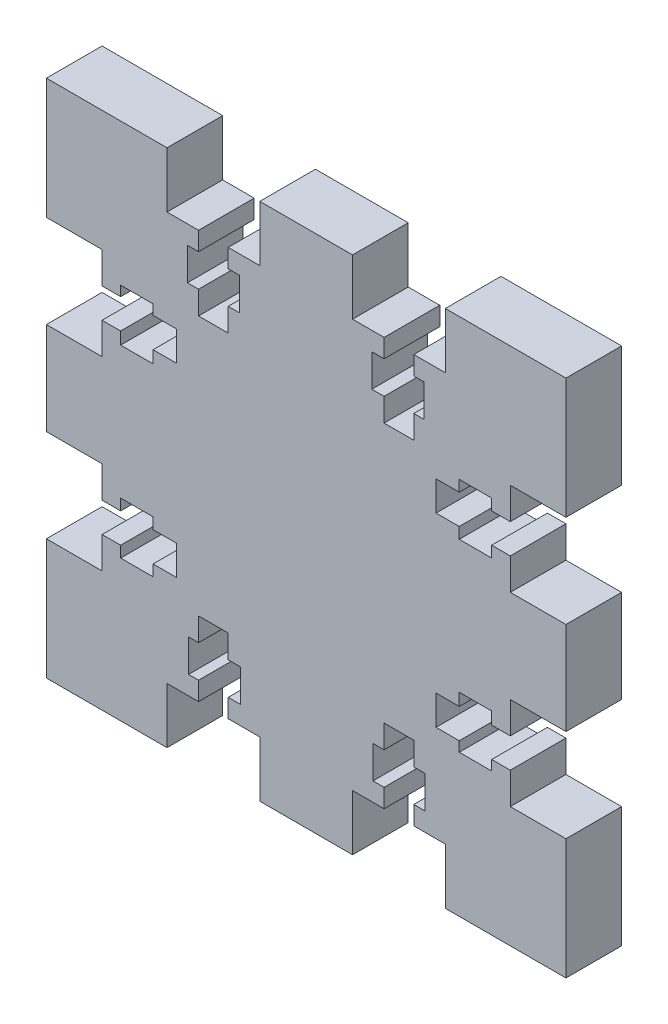
from build123d import *

# Parameters (mm, degrees)
SKETCH1_W           = 56
SKETCH1_H           = 56
BOSS_EXTRUDE1_DEPTH = 6
SKETCH2_W           = 10
SKETCH2_H           = 6
SKETCH2_W_2         = 6
SKETCH2_H_2         = 10
CUT_EXTRUDE1_DEPTH  = 54.425204723
SKETCH4_W           = 3.2
SKETCH4_H           = 6
CUT_EXTRUDE2_DEPTH  = 8
SKETCH10_W          = 6
SKETCH10_H          = 3.2
CUT_EXTRUDE7_DEPTH  = 8
SKETCH11_W          = 3.2
SKETCH11_H          = 6
CUT_EXTRUDE8_DEPTH  = 8
SKETCH12_W          = 6
SKETCH12_H          = 3.2
CUT_EXTRUDE9_DEPTH  = 8
SKETCH13_W          = 3.5
SKETCH13_H          = 5.6
SKETCH13_W_2        = 5.6
SKETCH13_H_2        = 3.5
CUT_EXTRUDE10_DEPTH = 54.425204723


with BuildPart() as part:
    # Sketch1 → Boss-Extrude1 (new body)
    with BuildSketch(Plane.XY):
        with Locations((6.733082315, -12.148044693)):
            Rectangle(SKETCH1_W, SKETCH1_H)
    extrude(amount=BOSS_EXTRUDE1_DEPTH)

    # Sketch2 → Cut-Extrude1 (cut, through all)
    with BuildSketch(Plane.XY.offset(6)):
        with Locations((-3.266917685, 12.851955307)):
            Rectangle(SKETCH2_W, SKETCH2_H)
        with Locations((16.733082315, 12.851955307)):
            Rectangle(SKETCH2_W, SKETCH2_H)
        with Locations((31.733082315, -2.148044693)):
            Rectangle(SKETCH2_W_2, SKETCH2_H_2)
        with Locations((31.733082315, -22.148044693)):
            Rectangle(SKETCH2_W_2, SKETCH2_H_2)
        with Locations((16.733082315, -37.148044693)):
            Rectangle(SKETCH2_W, SKETCH2_H)
        with Locations((-3.266917685, -37.148044693)):
            Rectangle(SKETCH2_W, SKETCH2_H)
        with Locations((-18.266917685, -22.148044693)):
            Rectangle(SKETCH2_W_2, SKETCH2_H_2)
        with Locations((-18.266917685, -2.148044693)):
            Rectangle(SKETCH2_W_2, SKETCH2_H_2)
    extrude(amount=-CUT_EXTRUDE1_DEPTH, mode=Mode.SUBTRACT)

    # Sketch4 → Cut-Extrude2 (cut)
    with BuildSketch(Plane(origin=(0, 9.851955307, 0), x_dir=(1, 0, 0), z_dir=(0, 1, 0))):
        with Locations((16.733082315, -3)):
            Rectangle(SKETCH4_W, SKETCH4_H)
        with Locations((-3.266917685, -3)):
            Rectangle(SKETCH4_W, SKETCH4_H)
    extrude(amount=-CUT_EXTRUDE2_DEPTH, mode=Mode.SUBTRACT)

    # Sketch10 → Cut-Extrude7 (cut)
    with BuildSketch(Plane(origin=(28.733082315, 0, 0), x_dir=(0, 0, -1), z_dir=(1, 0, 0))):
        with Locations((-3, -2.148044693)):
            Rectangle(SKETCH10_W, SKETCH10_H)
        with Locations((-3, -22.148044693)):
            Rectangle(SKETCH10_W, SKETCH10_H)
    extrude(amount=-CUT_EXTRUDE7_DEPTH, mode=Mode.SUBTRACT)

    # Sketch11 → Cut-Extrude8 (cut)
    with BuildSketch(Plane.XZ.offset(34.148044693)):
        with Locations((16.733082315, 3)):
            Rectangle(SKETCH11_W, SKETCH11_H)
        with Locations((-3.266917685, 3)):
            Rectangle(SKETCH11_W, SKETCH11_H)
    extrude(amount=-CUT_EXTRUDE8_DEPTH, mode=Mode.SUBTRACT)

    # Sketch12 → Cut-Extrude9 (cut)
    with BuildSketch(Plane.ZY.offset(15.266917685)):
        with Locations((3, -2.148044693)):
            Rectangle(SKETCH12_W, SKETCH12_H)
        with Locations((3, -22.148044693)):
            Rectangle(SKETCH12_W, SKETCH12_H)
    extrude(amount=-CUT_EXTRUDE9_DEPTH, mode=Mode.SUBTRACT)

    # Sketch13 → Cut-Extrude10 (cut, through all)
    with BuildSketch(Plane(origin=(0, 0, 0), x_dir=(-1, 0, 0), z_dir=(0, 0, -1))):
        with Locations((-24.983082315, -22.025968928)):
            Rectangle(SKETCH13_W, SKETCH13_H)
        with Locations((-16.61100655, 6.101955307)):
            Rectangle(SKETCH13_W_2, SKETCH13_H_2)
        with Locations((-24.983082315, -2.148044693)):
            Rectangle(SKETCH13_W, SKETCH13_H)
        with Locations((3.266917685, 6.101955307)):
            Rectangle(SKETCH13_W_2, SKETCH13_H_2)
        with Locations((11.516917685, -2.270120458)):
            Rectangle(SKETCH13_W, SKETCH13_H)
        with Locations((11.516917685, -22.148044693)):
            Rectangle(SKETCH13_W, SKETCH13_H)
        with Locations((3.14484192, -30.398044693)):
            Rectangle(SKETCH13_W_2, SKETCH13_H_2)
        with Locations((-16.733082315, -30.398044693)):
            Rectangle(SKETCH13_W_2, SKETCH13_H_2)
    extrude(amount=-CUT_EXTRUDE10_DEPTH, mode=Mode.SUBTRACT)


solid = part.part
